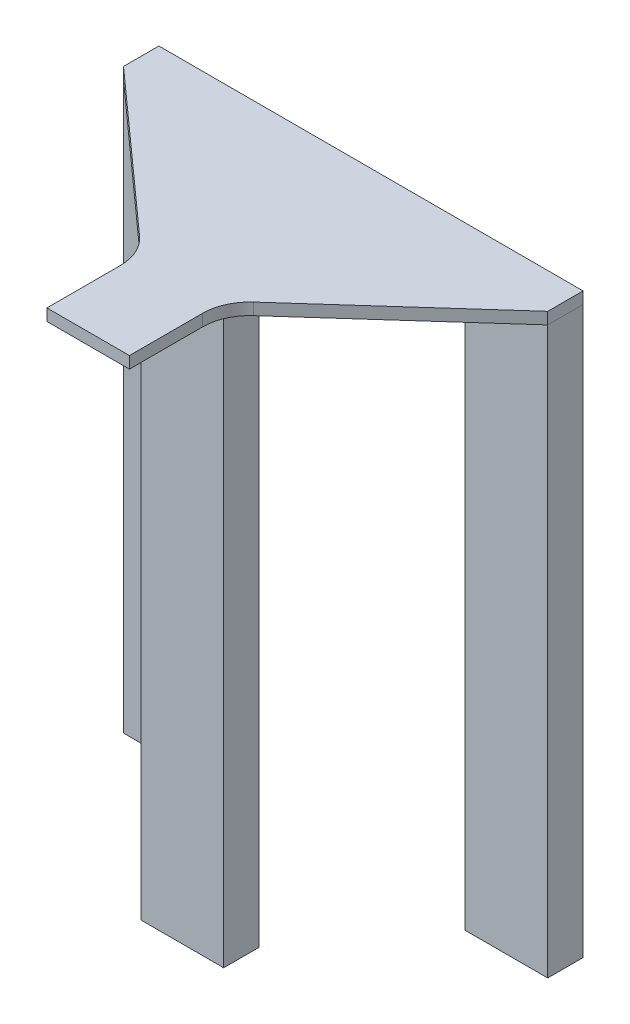
from build123d import *

# Parameters (mm, degrees)
BOSS_EXTRUDE1_DEPTH   = 12.7
SKETCH1_3_W           = 88.9
SKETCH1_3_H           = 38.1
BOSS_EXTRUDE2_DEPTH   = 609.6
BOSS_EXTRUDE2_2_DEPTH = 609.6
BOSS_EXTRUDE2_3_DEPTH = 609.6
FILLET1_R             = 50.8


with BuildPart() as part:
    # Sketch1 → Boss-Extrude1 (new body)
    with BuildSketch(Plane(origin=(0, 0, 0), x_dir=(1, 0, 0), z_dir=(0, 1, 0))):
        Polygon((-228.6, 304.8), (-228.6, 266.7), (-44.45, 101.6), (-44.45, 0), (44.45, 0), (44.45, 101.6), (228.6, 266.7), (228.6, 304.8), align=None)
    extrude(amount=BOSS_EXTRUDE1_DEPTH)

    # Fillet1
    fillet1_edges = [part.edges().sort_by_distance(p)[0] for p in [
        (44.45, 6.35, -101.6),
        (-44.45, 6.35, -101.6),
    ]]
    fillet(fillet1_edges, radius=FILLET1_R)


with BuildPart() as body_2:
    # Sketch1<3> → Boss-Extrude2 (new body)
    with BuildSketch(Plane(origin=(0, 0, 0), x_dir=(1, 0, 0), z_dir=(0, 1, 0))):
        with Locations((-184.15, 285.75)):
            Rectangle(SKETCH1_3_W, SKETCH1_3_H)
    extrude(amount=-BOSS_EXTRUDE2_DEPTH)


with BuildPart() as body_3:
    # Sketch1<3> → Boss-Extrude2 2 (new body)
    with BuildSketch(Plane(origin=(0, 0, 0), x_dir=(1, 0, 0), z_dir=(0, 1, 0))):
        with Locations((184.15, 285.75)):
            Rectangle(SKETCH1_3_W, SKETCH1_3_H)
    extrude(amount=-BOSS_EXTRUDE2_2_DEPTH)


with BuildPart() as body_4:
    # Sketch1<3> → Boss-Extrude2 3 (new body)
    with BuildSketch(Plane(origin=(0, 0, 0), x_dir=(1, 0, 0), z_dir=(0, 1, 0))):
        with Locations((0, 120.65)):
            Rectangle(SKETCH1_3_W, SKETCH1_3_H)
    extrude(amount=-BOSS_EXTRUDE2_3_DEPTH)


solid = Compound([part.part, body_2.part, body_3.part, body_4.part])
